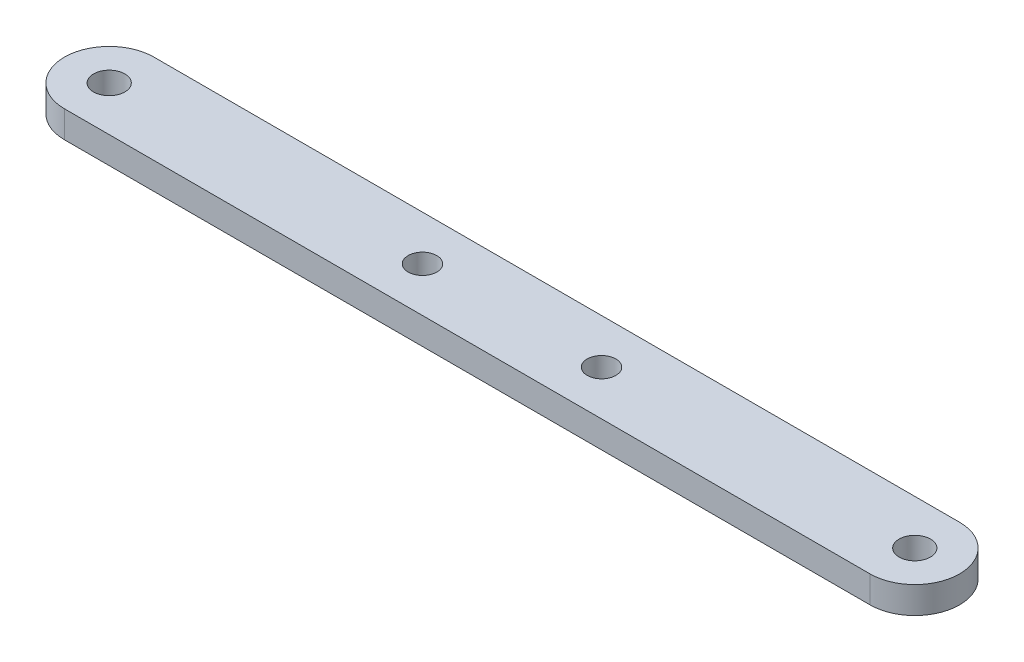
from build123d import *

# Parameters (mm, degrees)
SKETCH1_R           = 1.75
SKETCH1_R_2         = 1.6
BOSS_EXTRUDE1_DEPTH = 3


with BuildPart() as part:
    # Sketch1 → Boss-Extrude1 (new body)
    with BuildSketch(Plane(origin=(0, 0, 0), x_dir=(1, 0, 0), z_dir=(0, 1, 0))):
        with BuildLine():
            Line((-45, 5), (45, 5))
            ThreePointArc((45, 5), (50, 0), (45, -5))
            Line((45, -5), (-45, -5))
            ThreePointArc((-45, -5), (-50, 0), (-45, 5))
        make_face()
        with Locations(Location((-45, 0, 0), (0, 0, 270))):
            Circle(SKETCH1_R, mode=Mode.SUBTRACT)
        with Locations(Location((45, 0, 0), (0, 0, 90))):
            Circle(SKETCH1_R, mode=Mode.SUBTRACT)
        with Locations(Location((-10, 0, 0), (0, 0, 270))):
            Circle(SKETCH1_R_2, mode=Mode.SUBTRACT)
        with Locations(Location((10, 0, 0), (0, 0, 90))):
            Circle(SKETCH1_R_2, mode=Mode.SUBTRACT)
    extrude(amount=BOSS_EXTRUDE1_DEPTH)


solid = part.part
